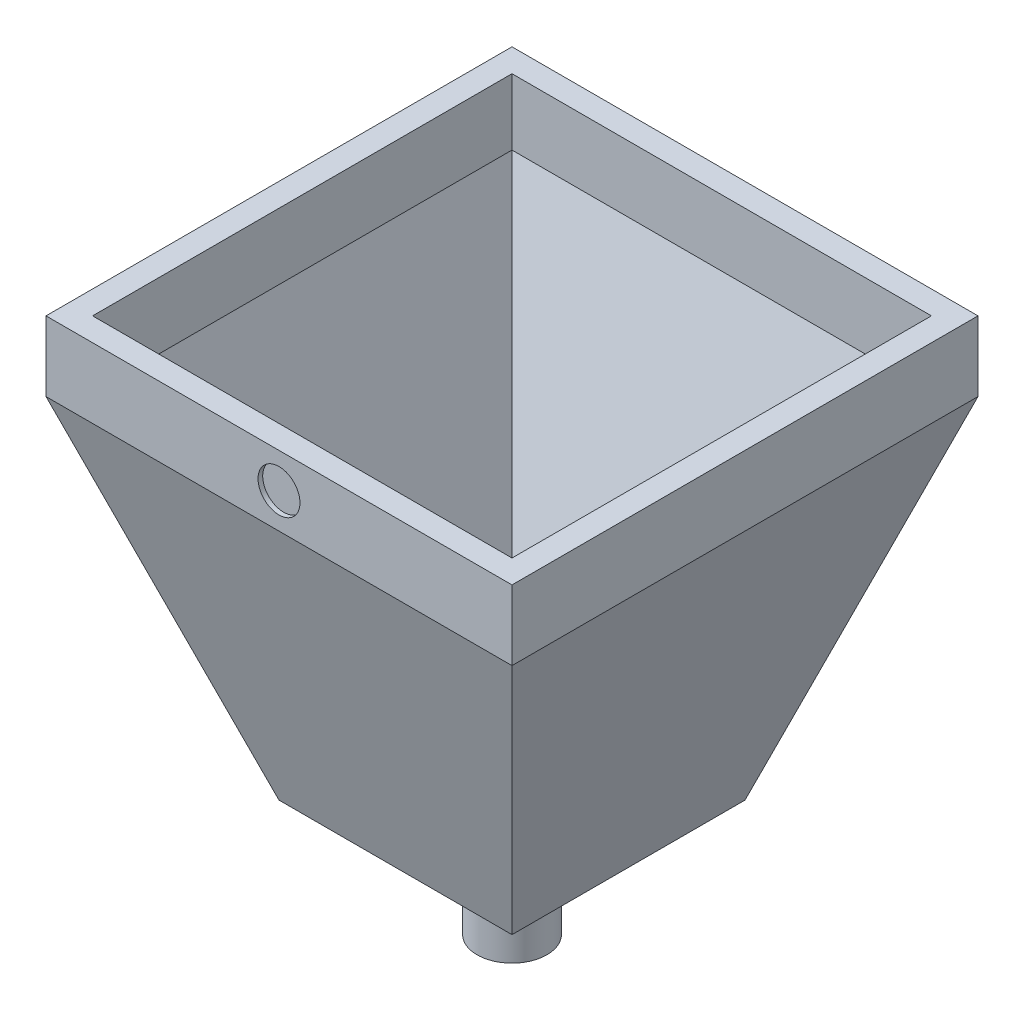
from build123d import *

# Parameters (mm, degrees)
CROQUIS3_W                 = 20
CROQUIS3_H                 = 20
SALIENTE_EXTRUIR1_DEPTH    = 3
VACIADO2_T                 = -1
CROQUIS4_R                 = 1.5
CORTAR_EXTRUIR1_DEPTH      = 3
CROQUIS5_R                 = 1.5
SALIENTE_EXTRUIR2_DEPTH    = 5
CROQUIS6_R                 = 1.355898714
CORTAR_EXTRUIR2_DEPTH      = 15
CROQUIS7_R                 = 1
SALIENTE_EXTRUIR4_DEPTH    = 1.5
CORTAR_EXTRUIR3_DEPTH      = 31.5
CORTAR_EXTRUIR3_DEPTH_BACK = 1.5
CROQUIS10_R                = 1.406391719
CROQUIS11_R                = 0.9
CORTAR_EXTRUIR4_DEPTH      = 0.2
CORTAR_EXTRUIR5_START      = -0.2
CROQUIS12_R                = 0.9
CORTAR_EXTRUIR5_DEPTH      = 0.2


with BuildPart() as part:
    # Croquis2 → Recubrir1 section 0
    with BuildSketch(Plane(origin=(0, 15, 0), x_dir=(1, 0, 0), z_dir=(0, 1, 0))):
        with BuildLine():
            Line((-10, -10), (10, -10))
            Line((10, -10), (10, 10))
            Line((10, 10), (-10, 10))
            Line((-10, 10), (-10, -10))
        make_face()
    # Croquis1 → Recubrir1 section 1
    with BuildSketch(Plane(origin=(0, 0, 0), x_dir=(1, 0, 0), z_dir=(0, 1, 0))):
        with BuildLine():
            Line((-5, -5), (5, -5))
            Line((5, -5), (5, 5))
            Line((5, 5), (-5, 5))
            Line((-5, 5), (-5, -5))
        make_face()
    loft()

    # Croquis3 → Saliente-Extruir1 (add)
    with BuildSketch(Plane(origin=(0, 15, 0), x_dir=(1, 0, 0), z_dir=(0, 1, 0))):
        Rectangle(CROQUIS3_W, CROQUIS3_H)
    extrude(amount=SALIENTE_EXTRUIR1_DEPTH)

    # Vaciado2
    vaciado2_openings = [part.faces().sort_by_distance(p)[0] for p in [
        (0, 18, 0),
    ]]
    offset(amount=VACIADO2_T, openings=vaciado2_openings, kind=Kind.INTERSECTION)

    # Croquis4 → Cortar-Extruir1 (cut)
    with BuildSketch(Plane(origin=(0, 0, 0), x_dir=(-1, 0, 0), z_dir=(0, -1, 0))):
        with Locations(Location((0, 0, 0), (0, 0, 90))):
            Circle(CROQUIS4_R)
    extrude(amount=-CORTAR_EXTRUIR1_DEPTH, mode=Mode.SUBTRACT)

    # Croquis11 → Cortar-Extruir4 (cut)
    with BuildSketch(Plane(origin=(0, 0, -10), x_dir=(-1, 0, 0), z_dir=(0, 0, -1))):
        with Locations((0, 16.5)):
            Circle(CROQUIS11_R)
    extrude(amount=-CORTAR_EXTRUIR4_DEPTH, mode=Mode.SUBTRACT)

    # Croquis12 → Cortar-Extruir5 (cut)
    with BuildSketch(Plane.XY.offset(10).offset(CORTAR_EXTRUIR5_START)):
        with Locations(Location((0, 16.5, 0), (0, 0, 180))):
            Circle(CROQUIS12_R)
    extrude(amount=CORTAR_EXTRUIR5_DEPTH, mode=Mode.SUBTRACT)


with BuildPart() as body_2:
    # Croquis5 → Saliente-Extruir2 (new body)
    with BuildSketch(Plane(origin=(0, 0, 0), x_dir=(-1, 0, 0), z_dir=(0, -1, 0))):
        with Locations(Location((0, 0, 0), (0, 0, 90))):
            Circle(CROQUIS5_R)
    extrude(amount=SALIENTE_EXTRUIR2_DEPTH)

    # Croquis6 → Cortar-Extruir2 (cut)
    with BuildSketch(Plane(origin=(0, -5, 0), x_dir=(-1, 0, 0), z_dir=(0, -1, 0))):
        with Locations(Location((0, 0, 0), (0, 0, 90))):
            Circle(CROQUIS6_R)
    extrude(amount=-CORTAR_EXTRUIR2_DEPTH, mode=Mode.SUBTRACT)

    # Croquis7 → Saliente-Extruir4 (add)
    with BuildSketch(Plane(origin=(0, 0, 0), x_dir=(0, 0, -1), z_dir=(1, 0, 0))):
        with Locations(Location((0, -2.4391778, 0), (0, 0, 180))):
            Circle(CROQUIS7_R)
    extrude(amount=SALIENTE_EXTRUIR4_DEPTH)

    # Croquis10 → Cortar-Extruir3 (cut, two sides: drawn at the far end of the back side and taken through both)
    with BuildSketch(Plane(origin=(0, 0, 0), x_dir=(-1, 0, 0), z_dir=(0, -1, 0)).offset(-CORTAR_EXTRUIR3_DEPTH_BACK)):
        with Locations(Location((0, 0, 0), (0, 0, 90))):
            Circle(CROQUIS10_R)
    extrude(amount=CORTAR_EXTRUIR3_DEPTH + CORTAR_EXTRUIR3_DEPTH_BACK, mode=Mode.SUBTRACT)


solid = Compound([part.part, body_2.part])
